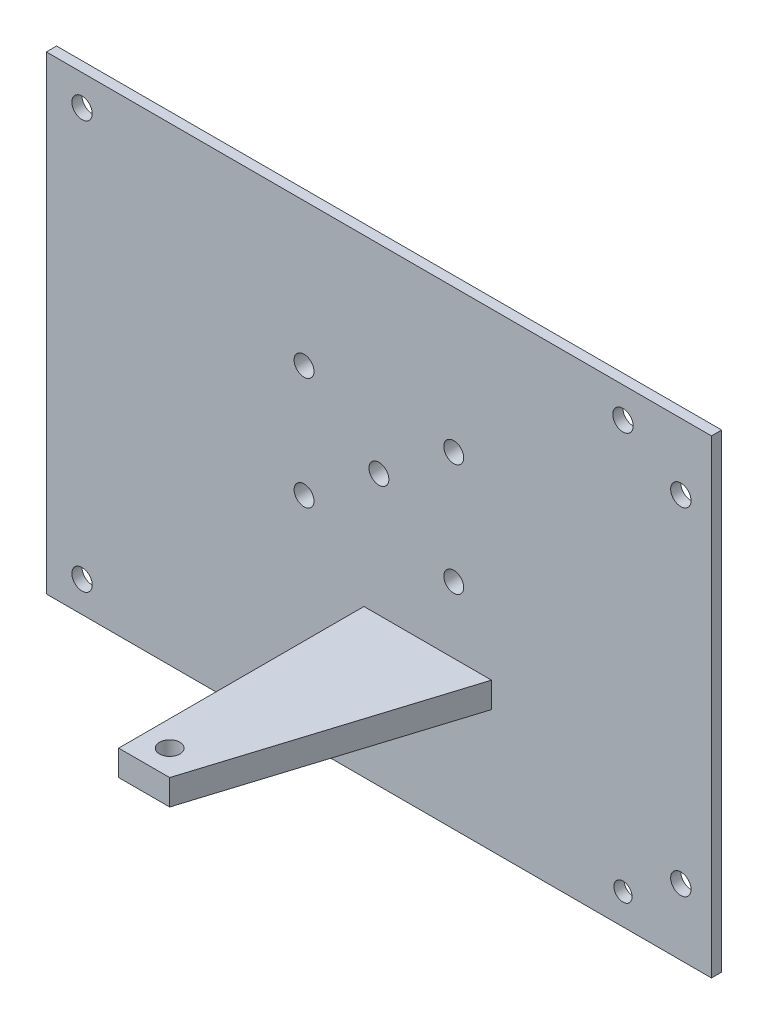
from build123d import *
from build123d.topology import SkipClean

# Parameters (mm, degrees)
SKETCH_1_W          = 130.33985981
SKETCH_1_H          = 92
SKETCH_1_R          = 2
SKETCH_1_R_2        = 1.785582523
SKETCH_1_R_3        = 1.95
EXTRUDE_1_DEPTH     = 1
EXTRUDE_START       = -24
SKETCH_2_R          = 2
EXTRUDE_2_DEPTH     = 5
EXTRUDE_START_2     = 6
SKETCH_3_W          = 40
SKETCH_3_H          = 30
SKETCH_3_R          = 1.95
EXTRUDE_3_DEPTH     = 6
CUT_EXTRUDE_START   = 4
SKETCH_5_R          = 1.95
CUT_EXTRUDE_3_DEPTH = 6


with BuildPart() as part:
    # 草图1 → 凸台-拉伸1 (new, symmetric)
    with BuildSketch(Plane.XY):
        with Locations((65.169929905, 43)):
            Rectangle(SKETCH_1_W, SKETCH_1_H)
        with Locations((124.33985981, 10)):
            Circle(SKETCH_1_R, mode=Mode.SUBTRACT)
        with Locations((124.33985981, 76)):
            Circle(SKETCH_1_R, mode=Mode.SUBTRACT)
        with Locations((7, 3)):
            Circle(SKETCH_1_R, mode=Mode.SUBTRACT)
        with Locations((113, 3)):
            Circle(SKETCH_1_R_2, mode=Mode.SUBTRACT)
        with Locations((7, 83)):
            Circle(SKETCH_1_R, mode=Mode.SUBTRACT)
        with Locations((113, 83)):
            Circle(SKETCH_1_R, mode=Mode.SUBTRACT)
        with Locations((65.169929905, 50)):
            Circle(SKETCH_1_R_3, mode=Mode.SUBTRACT)
    extrude(amount=EXTRUDE_1_DEPTH, both=True)

    # 草图2 → 凸台-拉伸2 (add)
    with BuildSketch(Plane.XZ.offset(3).offset(EXTRUDE_START)):
        Polygon((62.24, 49.07), (72.24, 49.07), (87.24, 1), (62.24, 1), align=None)
        with Locations(Location((67.24, 44.07, 0), (0, 0, 270))):
            Circle(SKETCH_2_R, mode=Mode.SUBTRACT)
    extrude(amount=-EXTRUDE_2_DEPTH)

    # 草图3 → 凸台-拉伸3 (add)
    with SkipClean():  # the faces are left unmerged after this step: merging them gives an invalid solid
        with BuildSketch(Plane(origin=(0, 0, -1), x_dir=(-1, 0, 0), z_dir=(0, 0, -1)).offset(EXTRUDE_START_2)):
            with Locations((-65.169929905, 50)):
                Rectangle(SKETCH_3_W, SKETCH_3_H)
            with Locations((-79.836596572, 61)):
                Circle(SKETCH_3_R, mode=Mode.SUBTRACT)
            with Locations((-50.503263238, 61)):
                Circle(SKETCH_3_R, mode=Mode.SUBTRACT)
            with Locations((-50.503263238, 39)):
                Circle(SKETCH_3_R, mode=Mode.SUBTRACT)
            with Locations((-79.836596572, 39)):
                Circle(SKETCH_3_R, mode=Mode.SUBTRACT)
            with Locations((-65.169929905, 50)):
                Circle(SKETCH_3_R, mode=Mode.SUBTRACT)
        extrude(amount=-EXTRUDE_3_DEPTH)

    # 草图5 → 切除-拉伸3 (cut)
    with SkipClean():  # the faces are left unmerged after this step: merging them gives an invalid solid
        with BuildSketch(Plane(origin=(0, 0, -1), x_dir=(-1, 0, 0), z_dir=(0, 0, -1)).offset(CUT_EXTRUDE_START)):
            with Locations((-50.503263238, 39)):
                Circle(SKETCH_5_R)
            with Locations((-79.836596572, 39)):
                Circle(SKETCH_5_R)
            with Locations((-79.836596572, 61)):
                Circle(SKETCH_5_R)
            with Locations((-50.503263238, 61)):
                Circle(SKETCH_5_R)
        extrude(amount=-CUT_EXTRUDE_3_DEPTH, mode=Mode.SUBTRACT)


solid = part.part
